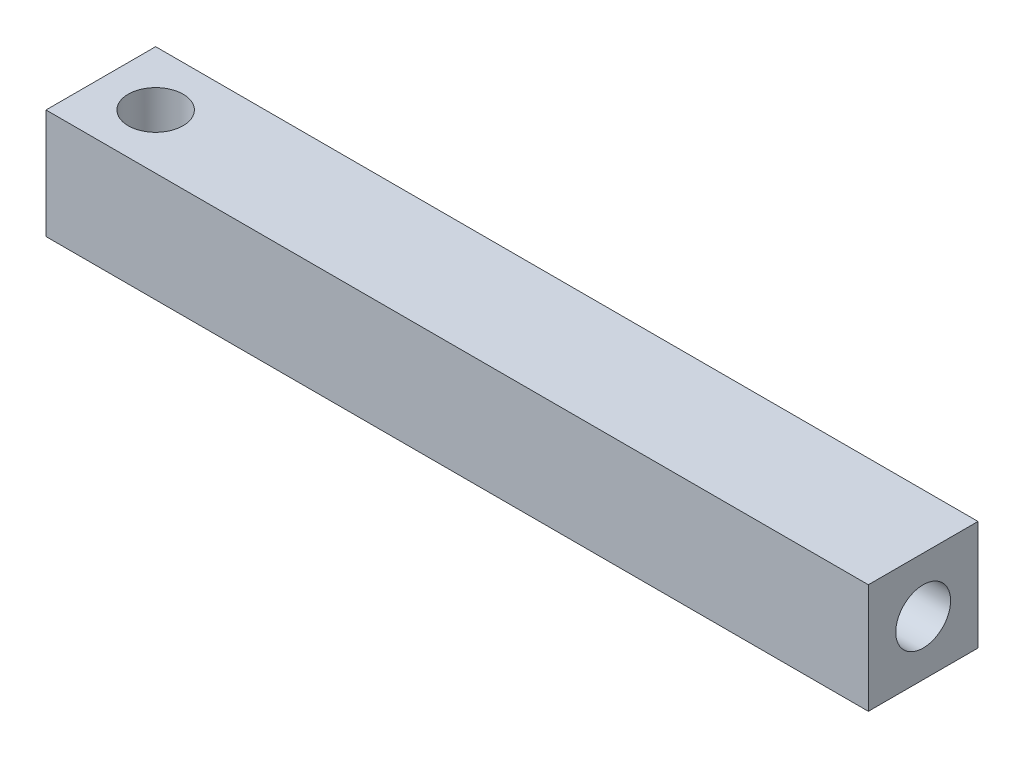
from build123d import *

# Parameters (mm, degrees)
SKETCH1_W               = 40
SKETCH1_H               = 40
BOSS_EXTRUDE1_DEPTH     = 300
CUT_EXTRUDE1_DEPTH      = 100
CUT_EXTRUDE1_DEPTH_BACK = 100
SKETCH2_R               = 10
CUT_EXTRUDE2_DEPTH      = 50
CUT_EXTRUDE2_DEPTH_BACK = 50
SKETCH3_R               = 10
SKETCH4_W               = 40
SKETCH4_H               = 40
BOSS_EXTRUDE2_DEPTH     = 300
CUT_EXTRUDE3_DEPTH      = 80
CUT_EXTRUDE3_DEPTH_BACK = 80
SKETCH5_R               = 10
SKETCH6_R               = 10
CUT_EXTRUDE4_DEPTH      = 30


with BuildPart() as part:
    # Sketch1 → Boss-Extrude1 (new body)
    with BuildSketch(Plane(origin=(0, 0, 0), x_dir=(0, 0, -1), z_dir=(1, 0, 0))):
        Rectangle(SKETCH1_W, SKETCH1_H)
    extrude(amount=BOSS_EXTRUDE1_DEPTH)

    # Sketch2 → Cut-Extrude1 (cut, two sides: drawn at the far end of the back side and taken through both)
    with BuildSketch(Plane(origin=(0, 0, 0), x_dir=(1, 0, 0), z_dir=(0, 1, 0)).offset(-CUT_EXTRUDE1_DEPTH_BACK)):
        with Locations((20, 0)):
            Circle(SKETCH2_R)
    extrude(amount=CUT_EXTRUDE1_DEPTH + CUT_EXTRUDE1_DEPTH_BACK, mode=Mode.SUBTRACT)

    # Sketch3 → Cut-Extrude2 (cut, two sides: drawn at the far end of the back side and taken through both)
    with BuildSketch(Plane(origin=(300, 0, 0), x_dir=(0, 0, -1), z_dir=(1, 0, 0)).offset(-CUT_EXTRUDE2_DEPTH_BACK)):
        Circle(SKETCH3_R)
    extrude(amount=CUT_EXTRUDE2_DEPTH + CUT_EXTRUDE2_DEPTH_BACK, mode=Mode.SUBTRACT)

    # Sketch4 → Boss-Extrude2 (add)
    with BuildSketch(Plane(origin=(0, 0, 0), x_dir=(0, 0, -1), z_dir=(1, 0, 0))):
        Rectangle(SKETCH4_W, SKETCH4_H)
    extrude(amount=BOSS_EXTRUDE2_DEPTH)

    # Sketch5 → Cut-Extrude3 (cut, two sides: drawn at the far end of the back side and taken through both)
    with BuildSketch(Plane(origin=(0, 0, 0), x_dir=(1, 0, 0), z_dir=(0, 1, 0)).offset(-CUT_EXTRUDE3_DEPTH_BACK)):
        with Locations((20, 0)):
            Circle(SKETCH5_R)
    extrude(amount=CUT_EXTRUDE3_DEPTH + CUT_EXTRUDE3_DEPTH_BACK, mode=Mode.SUBTRACT)

    # Sketch6 → Cut-Extrude4 (cut)
    with BuildSketch(Plane(origin=(300, 0, 0), x_dir=(0, 0, -1), z_dir=(1, 0, 0))):
        Circle(SKETCH6_R)
    extrude(amount=-CUT_EXTRUDE4_DEPTH, mode=Mode.SUBTRACT)


solid = part.part
